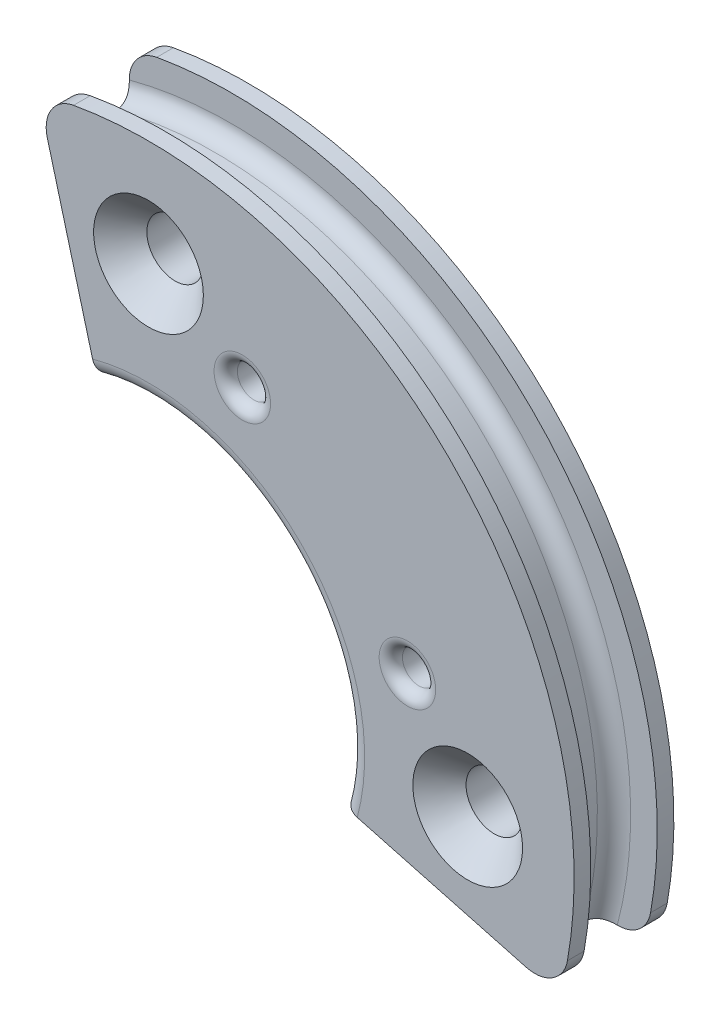
from build123d import *

# Parameters (mm, degrees)
SKETCH1_R               = 12
SKETCH1_R_2             = 0.85
SKETCH1_R_3             = 6
BOSS_EXTRUDE1_DEPTH     = 1.5
SKETCH6_W               = 0.8
SKETCH6_H               = 0.5
CUT_EXTRUDE1_DEPTH      = 19.163975336
CUT_EXTRUDE1_DEPTH_BACK = 19.163975336
CUT_EXTRUDE2_DEPTH      = 19.348841925
CUT_EXTRUDE2_DEPTH_BACK = 19.348841925
SKETCH5_R               = 0.5
FILLET1_R               = 0.5
FILLET2_R               = 1
CHAMFER1_SIZE           = 0.8
FILLET3_R               = 0.35
FILLET4_R               = 0.35


with BuildPart() as part:
    # Sketch1 → Boss-Extrude1 (new, symmetric)
    with BuildSketch(Plane.XY):
        Circle(SKETCH1_R)
        with Locations((9.6, 0)):
            Circle(SKETCH1_R_2, mode=Mode.SUBTRACT)
        Circle(SKETCH1_R_3, mode=Mode.SUBTRACT)
        with Locations((0, -9.6)):
            Circle(SKETCH1_R_2, mode=Mode.SUBTRACT)
        with Locations((-9.6, 0)):
            Circle(SKETCH1_R_2, mode=Mode.SUBTRACT)
        with Locations((0, 9.6)):
            Circle(SKETCH1_R_2, mode=Mode.SUBTRACT)
    extrude(amount=BOSS_EXTRUDE1_DEPTH, both=True)

    # Sketch2 → Cut-Revolve1 (revolve, cut)
    with BuildSketch(Plane(origin=(0, 0, 0), x_dir=(1, 0, 0), z_dir=(0, 1, 0)), mode=Mode.PRIVATE) as cut_revolve1_sk:
        with BuildLine():
            Line((-11.5, 0.5), (-11.5, -0.5))
            ThreePointArc((-11.5, -0.5), (-11.646446609, -0.853553391), (-12, -1))
            Line((-12, -1), (-12, 1))
            ThreePointArc((-12, 1), (-11.646446609, 0.853553391), (-11.5, 0.5))
        make_face()
    revolve(cut_revolve1_sk.sketch.rotate(Axis((0, 0, 0), (0, 0, -1)), 180), axis=Axis((0, 0, 0), (0, 0, -1)), mode=Mode.SUBTRACT)

    # Sketch6 → Revolve1 (revolve)
    with BuildSketch(Plane(origin=(0, 0, 0), x_dir=(1, 0, 0), z_dir=(0, 1, 0))):
        with Locations((12.4, 1.25)):
            Rectangle(SKETCH6_W, SKETCH6_H)
        with Locations((12.4, -1.25)):
            Rectangle(SKETCH6_W, SKETCH6_H)
    revolve(axis=Axis((0, 0, 0), (0, 0, -1)))

    # Sketch4 → Cut-Extrude1 (cut, two sides: drawn at the far end of the back side and taken through both)
    with BuildSketch(Plane.XY.offset(-CUT_EXTRUDE1_DEPTH_BACK)):
        Polygon((-3.743635752, 13.97143883), (0, 0), (14.900233226, -3.99250546), (14.900233226, -14.839385646), (-15.188066433, -14.839385646), (-15.188066433, 13.97143883), align=None)
    extrude(amount=CUT_EXTRUDE1_DEPTH + CUT_EXTRUDE1_DEPTH_BACK, mode=Mode.SUBTRACT)

    # Sketch5 → Cut-Extrude2 (cut, two sides: drawn at the far end of the back side and taken through both)
    with BuildSketch(Plane.XY.offset(1.5).offset(-CUT_EXTRUDE2_DEPTH_BACK)):
        with Locations((2.82143232, 7.787460269)):
            Circle(SKETCH5_R)
        with Locations((7.787460269, 2.82143232)):
            Circle(SKETCH5_R)
    extrude(amount=CUT_EXTRUDE2_DEPTH + CUT_EXTRUDE2_DEPTH_BACK, mode=Mode.SUBTRACT)

    # Fillet1
    fillet1_edges = [part.edges().sort_by_distance(p)[0] for p in [
        (4.242640687, 4.242640687, 1.5),
        (4.242640687, 4.242640687, -1.5),
    ]]
    fillet(fillet1_edges, radius=FILLET1_R)

    # Fillet2
    fillet2_edges = [part.edges().sort_by_distance(p)[0] for p in [
        (12.363850577, -3.312883777, -1.25),
        (12.363850577, -3.312883777, 1.25),
        (-3.312883777, 12.363850577, -1.25),
        (-3.312883777, 12.363850577, 1.25),
    ]]
    fillet(fillet2_edges, radius=FILLET2_R)

    # Chamfer1
    chamfer1_edges = [part.edges().sort_by_distance(p)[0] for p in [
        (8.75, 0, 1.5),
        (-0.85, 9.6, 1.5),
    ]]
    chamfer(chamfer1_edges, length=CHAMFER1_SIZE)

    # Fillet3
    fillet3_edges = [part.edges().sort_by_distance(p)[0] for p in [
        (2.32143232, 7.787460269, 1.5),
        (7.287460269, 2.82143232, 1.5),
    ]]
    fillet(fillet3_edges, radius=FILLET3_R)

    # Fillet4
    fillet4_edges = [part.edges().sort_by_distance(p)[0] for p in [
        (2.32143232, 7.787460269, -1.5),
        (7.287460269, 2.82143232, -1.5),
    ]]
    fillet(fillet4_edges, radius=FILLET4_R)


solid = part.part
